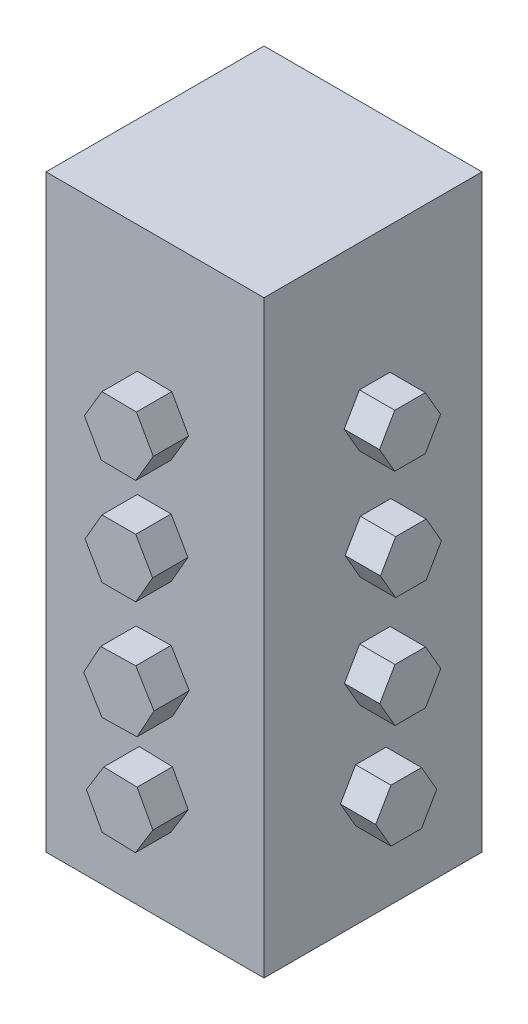
from build123d import *

# Parameters (mm, degrees)
SKETCH1_W                = 37
SKETCH1_H                = 37
BOSS_EXTRUDE1_DEPTH      = 100
BOSS_EXTRUDE2_DEPTH      = 6
BOSS_EXTRUDE2_DEPTH_BACK = 43
BOSS_EXTRUDE3_DEPTH      = 6
BOSS_EXTRUDE3_DEPTH_BACK = 43


with BuildPart() as part:
    # Sketch1 → Boss-Extrude1 (new body)
    with BuildSketch(Plane(origin=(0, 0, 0), x_dir=(1, 0, 0), z_dir=(0, 1, 0))):
        Rectangle(SKETCH1_W, SKETCH1_H)
    extrude(amount=BOSS_EXTRUDE1_DEPTH)

    # Sketch2 → Boss-Extrude2 (add, two sides: drawn at the far end of the back side and taken through both)
    with BuildSketch(Plane.ZY.offset(18.5).offset(-BOSS_EXTRUDE2_DEPTH_BACK)):
        Polygon((2.947677665, 14.601477232), (5.53699788, 19.086311402), (2.947677665, 23.571145571), (-2.230962765, 23.571145571), (-4.82028298, 19.086311402), (-2.230962765, 14.601477232), align=None)
        Polygon((2.265923415, 31.999576723), (4.85524363, 36.484410892), (2.265923415, 40.969245062), (-2.912717015, 40.969245062), (-5.50203723, 36.484410892), (-2.912717015, 31.999576723), align=None)
        Polygon((2.148184021, 50.736854031), (4.737504236, 55.221688201), (2.148184021, 59.70652237), (-3.030456409, 59.70652237), (-5.619776624, 55.221688201), (-3.030456409, 50.736854031), align=None)
        Polygon((2.302648162, 69.385244476), (4.891968377, 73.870078646), (2.302648162, 78.354912815), (-2.875992268, 78.354912815), (-5.465312483, 73.870078646), (-2.875992268, 69.385244476), align=None)
    extrude(amount=BOSS_EXTRUDE2_DEPTH + BOSS_EXTRUDE2_DEPTH_BACK)

    # Sketch3 → Boss-Extrude3 (add, two sides: drawn at the far end of the back side and taken through both)
    with BuildSketch(Plane.XY.offset(18.5).offset(-BOSS_EXTRUDE3_DEPTH_BACK)):
        Polygon((2.683056757, 13.510428104), (5.640179705, 18.315850916), (2.957122948, 23.279505916), (-2.683056757, 23.437738105), (-5.640179705, 18.632315293), (-2.957122948, 13.668660293), align=None)
        Polygon((2.957122948, 30.681991349), (5.824876018, 35.910513005), (2.730719975, 41.008320843), (-3.231189138, 40.877607026), (-6.098942208, 35.64908537), (-3.004786166, 30.551277532), align=None)
        Polygon((2.730719975, 50.402458514), (5.595494766, 55.367833024), (2.727741696, 60.331488025), (-3.004786166, 60.329768515), (-5.869560957, 55.364394004), (-3.001807886, 50.400739003), align=None)
        Polygon((2.727741696, 68.244785948), (5.709440822, 73.275947245), (2.843176891, 78.373755084), (-3.004786166, 78.440401625), (-5.986485292, 73.409240328), (-3.120221361, 68.311432489), align=None)
    extrude(amount=BOSS_EXTRUDE3_DEPTH + BOSS_EXTRUDE3_DEPTH_BACK)


solid = part.part
